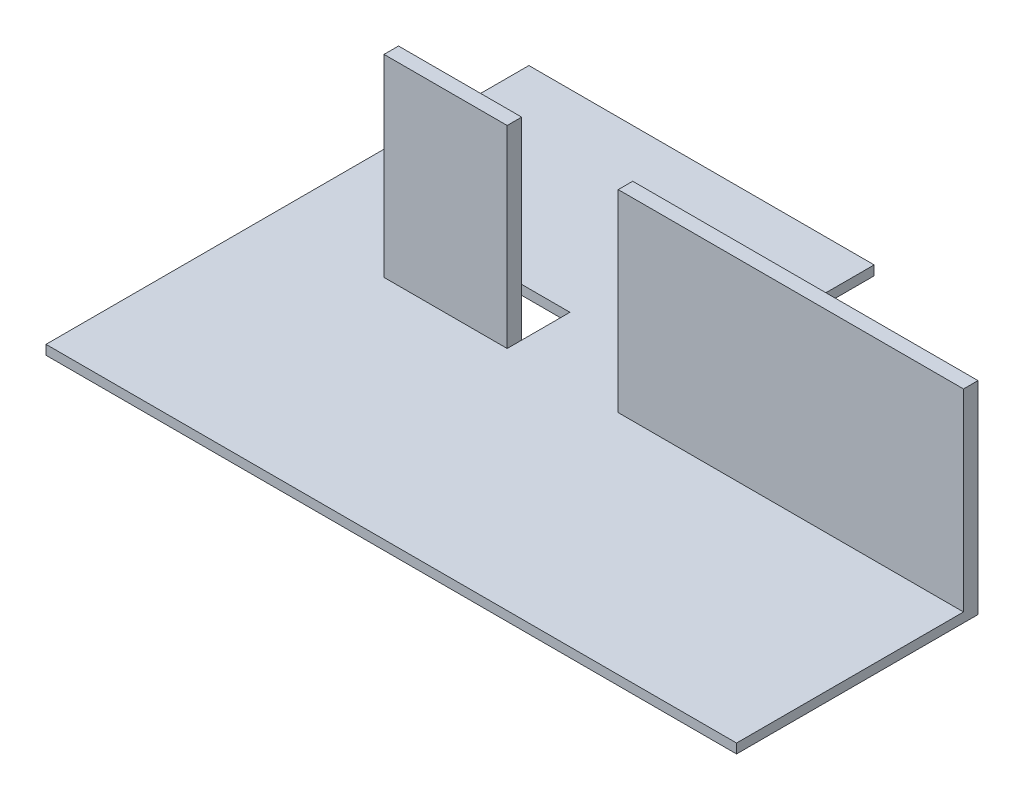
from build123d import *

# Parameters (mm, degrees)
SKETCH1_W           = 6.477
SKETCH1_H           = 2.54
BOSS_EXTRUDE1_DEPTH = 0.5
SKETCH2_W           = 6.477
SKETCH2_H           = 0.762
SKETCH2_W_2         = 18.161
BOSS_EXTRUDE2_DEPTH = 10.16


with BuildPart() as part:
    # Sketch1 → Boss-Extrude1 (new body)
    with BuildSketch(Plane(origin=(0, 0, 0), x_dir=(1, 0, 0), z_dir=(0, 1, 0))):
        Polygon((-18.161, -12.7), (18.161, -12.7), (18.161, 0), (0, 0), (0, 12.7), (-18.161, 12.7), align=None)
        with Locations((-9.0805, 1.27)):
            Rectangle(SKETCH1_W, SKETCH1_H, mode=Mode.SUBTRACT)
    extrude(amount=BOSS_EXTRUDE1_DEPTH)

    # Sketch2 → Boss-Extrude2 (add)
    with BuildSketch(Plane(origin=(0, 0.5, 0), x_dir=(1, 0, 0), z_dir=(0, 1, 0))):
        with Locations((-9.0805, -0.381)):
            Rectangle(SKETCH2_W, SKETCH2_H)
        with Locations((9.0805, -0.381)):
            Rectangle(SKETCH2_W_2, SKETCH2_H)
    extrude(amount=BOSS_EXTRUDE2_DEPTH)


solid = part.part
